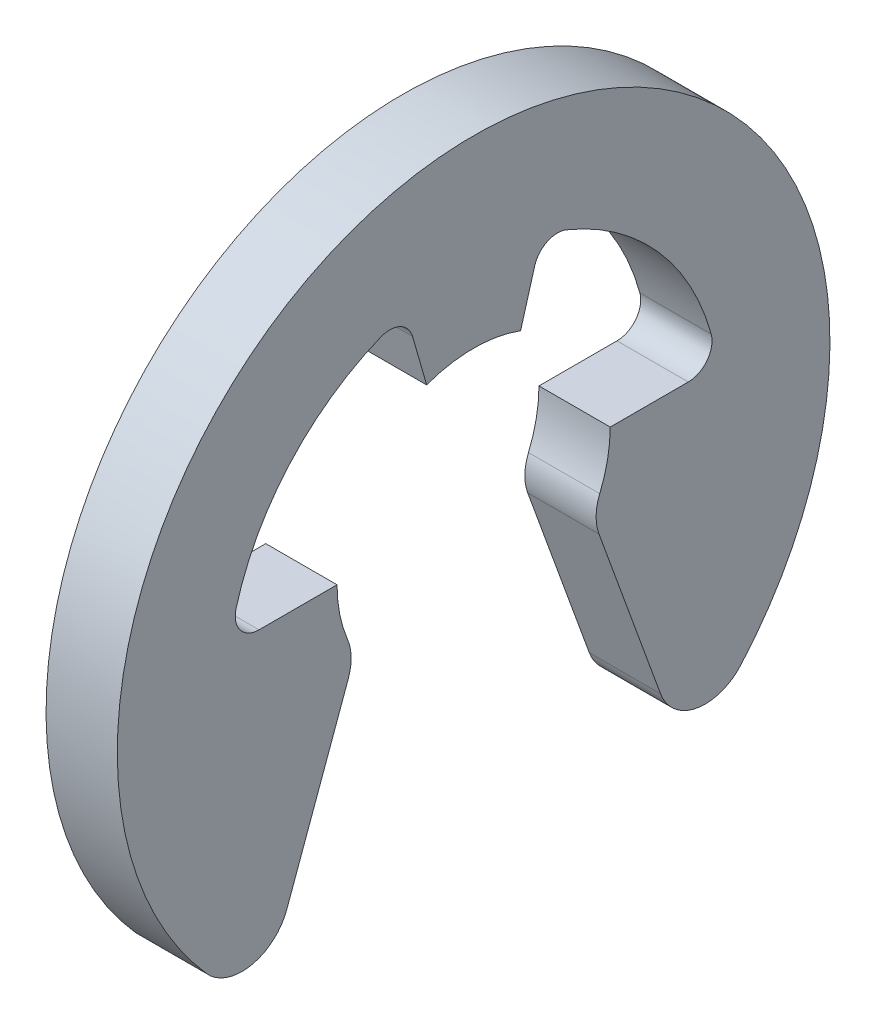
from build123d import *

# Parameters (mm, degrees)
BASE_EXTRUSION_DEPTH = 0.6


with BuildPart() as part:
    # Esquisse1 → Base-Extrusion (new body)
    with BuildSketch(Plane(origin=(0, 0, 0), x_dir=(0, 0, -1), z_dir=(1, 0, 0))):
        with BuildLine():
            Line((0.395650325, 1.379796657), (0.513871499, 1.792082889))
            ThreePointArc((0.513871499, 1.792082889), (0.618642921, 1.916808383), (0.781443715, 1.922230663))
            ThreePointArc((0.781443715, 1.922230663), (1.549962924, 1.379579622), (1.999861801, 0.553333333))
            ThreePointArc((1.999861801, 0.553333333), (1.966268522, 0.378893986), (1.807104037, 0.3))
            Line((1.807104037, 0.3), (1.15, 0.3))
            ThreePointArc((1.15, 0.3), (1.127723116, 0.074743316), (1.061755524, -0.141786383))
            ThreePointArc((1.061755524, -0.141786383), (1.031164095, -0.286405137), (1.055184744, -0.432259269))
            Line((1.055184744, -0.432259269), (1.573740622, -1.856979833))
            ThreePointArc((1.573740622, -1.856979833), (1.875274337, -2.113202397), (2.249558851, -1.984813588))
            ThreePointArc((2.249558851, -1.984813588), (0, 3), (-2.249558851, -1.984813588))
            ThreePointArc((-2.249558851, -1.984813588), (-1.875274337, -2.113202397), (-1.573740622, -1.856979833))
            Line((-1.573740622, -1.856979833), (-1.055184744, -0.432259269))
            ThreePointArc((-1.055184744, -0.432259269), (-1.031164095, -0.286405137), (-1.061755524, -0.141786383))
            ThreePointArc((-1.061755524, -0.141786383), (-1.127723116, 0.074743316), (-1.15, 0.3))
            Line((-1.15, 0.3), (-1.807104037, 0.3))
            ThreePointArc((-1.807104037, 0.3), (-1.966268522, 0.378893986), (-1.999861801, 0.553333333))
            ThreePointArc((-1.999861801, 0.553333333), (-1.549962924, 1.379579622), (-0.781443715, 1.922230663))
            ThreePointArc((-0.781443715, 1.922230663), (-0.618642921, 1.916808383), (-0.513871499, 1.792082889))
            Line((-0.513871499, 1.792082889), (-0.395650325, 1.379796657))
            ThreePointArc((-0.395650325, 1.379796657), (0, 1.45), (0.395650325, 1.379796657))
        make_face()
    extrude(amount=BASE_EXTRUSION_DEPTH)


solid = part.part
